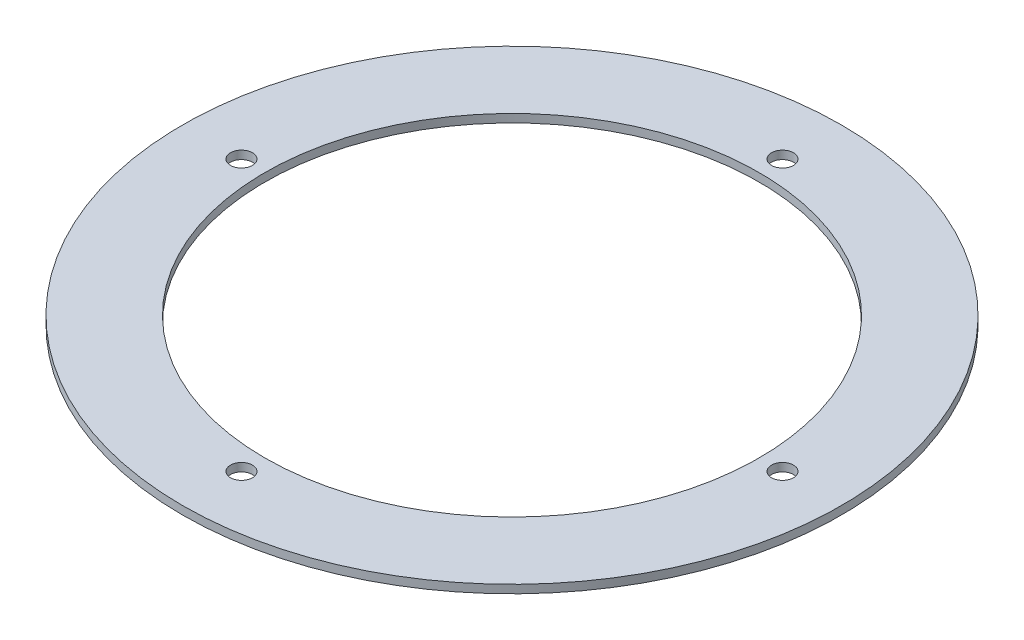
from build123d import *

# Parameters (mm, degrees)
SKETCH1_R           = 60
SKETCH1_R_2         = 45
SKETCH1_R_3         = 2
BOSS_EXTRUDE1_DEPTH = 1.5


with BuildPart() as part:
    # Sketch1 → Boss-Extrude1 (new body)
    with BuildSketch(Plane(origin=(0, 0, 0), x_dir=(1, 0, 0), z_dir=(0, 1, 0))):
        with Locations(Location((0, 0, 0), (0, 0, 270))):
            Circle(SKETCH1_R)
        with Locations(Location((0, 0, 0), (0, 0, 270))):
            Circle(SKETCH1_R_2, mode=Mode.SUBTRACT)
        with Locations(Location((-49.25, 0, 0), (0, 0, 270))):
            Circle(SKETCH1_R_3, mode=Mode.SUBTRACT)
        with Locations(Location((0, 49.25, 0), (0, 0, 270))):
            Circle(SKETCH1_R_3, mode=Mode.SUBTRACT)
        with Locations(Location((49.25, 0, 0), (0, 0, 270))):
            Circle(SKETCH1_R_3, mode=Mode.SUBTRACT)
        with Locations(Location((0, -49.25, 0), (0, 0, 270))):
            Circle(SKETCH1_R_3, mode=Mode.SUBTRACT)
    extrude(amount=BOSS_EXTRUDE1_DEPTH)


solid = part.part
